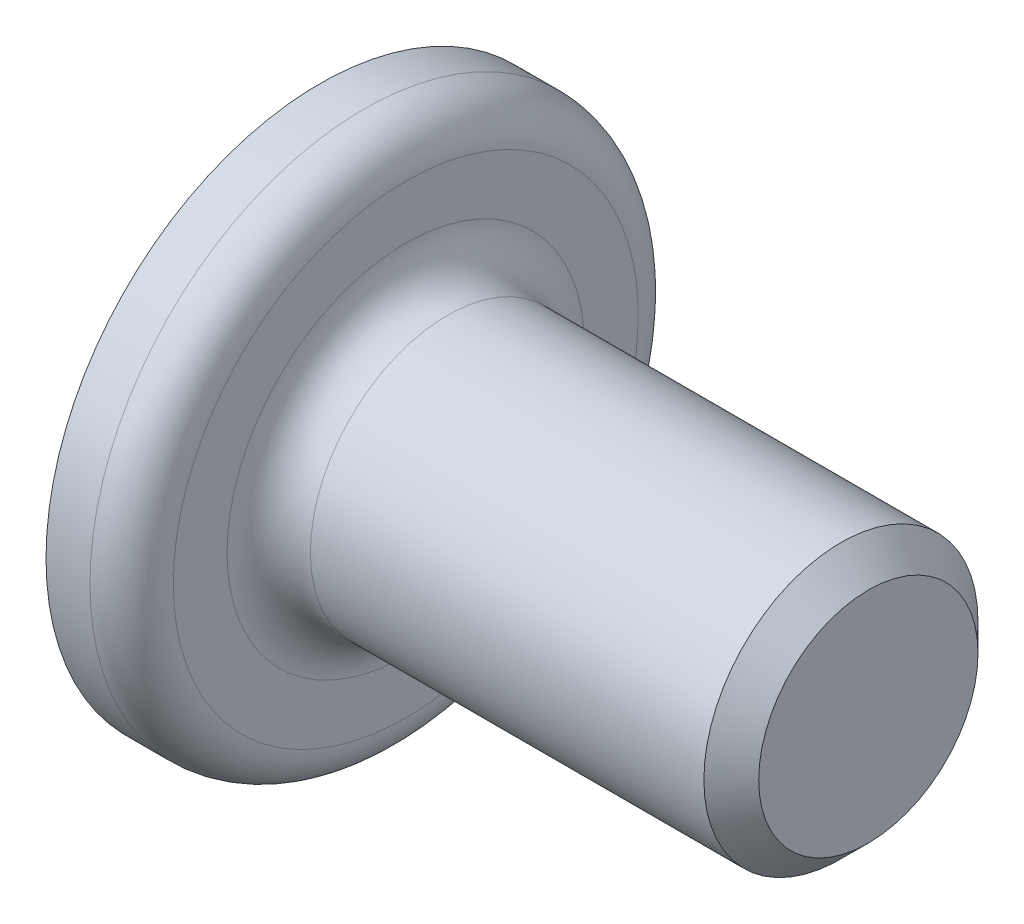
from build123d import *

# Parameters (mm, degrees)
CHAMFER1_SIZE     = 0.635
CIRPATTERN2_COUNT = 3
FILLET2_R         = 0.9652


with BuildPart() as part:
    # Sketch1 → Revolve1 (revolve)
    with BuildSketch(Plane.XY, mode=Mode.PRIVATE) as revolve1_sk:
        Polygon((0, 0), (0, 6.35), (1.984375, 6.35), (1.984375, 3.175), (12.7, 3.175), (12.7, 0), align=None)
    revolve(revolve1_sk.sketch.rotate(Axis((0, 0, 0), (1, 0, 0)), 90), axis=Axis((0, 0, 0), (1, 0, 0)))

    # Chamfer1
    chamfer1_edges = [part.edges().sort_by_distance(p)[0] for p in [
        (12.7, 0, -3.175),
    ]]
    chamfer(chamfer1_edges, length=CHAMFER1_SIZE)

    # Sketch3 → Revolve3 (revolve)
    with BuildSketch(Plane.XY):
        with BuildLine():
            Line((0, 4.7625), (-0.9652, 4.7625))
            ThreePointArc((-0.9652, 4.7625), (-0.694208674, 5.535036939), (0, 5.969))
            Line((0, 5.969), (0, 4.7625))
        make_face()
    revolve3 = revolve(axis=Axis((1.984375, 4.7625, 0), (-1, 0, 0)))

    # CirPattern2: Revolve3 ×3 about axis
    cirpattern2_axis = Axis((0, 0, 0), (1, 0, 0))
    for i in range(1, CIRPATTERN2_COUNT):
        add(revolve3.rotate(cirpattern2_axis, i * 360 / CIRPATTERN2_COUNT))

    # Fillet2
    fillet2_edges = [part.edges().sort_by_distance(p)[0] for p in [
        (1.984375, 0, -3.175),
        (1.984375, 0, -6.35),
    ]]
    fillet(fillet2_edges, radius=FILLET2_R)


solid = part.part
